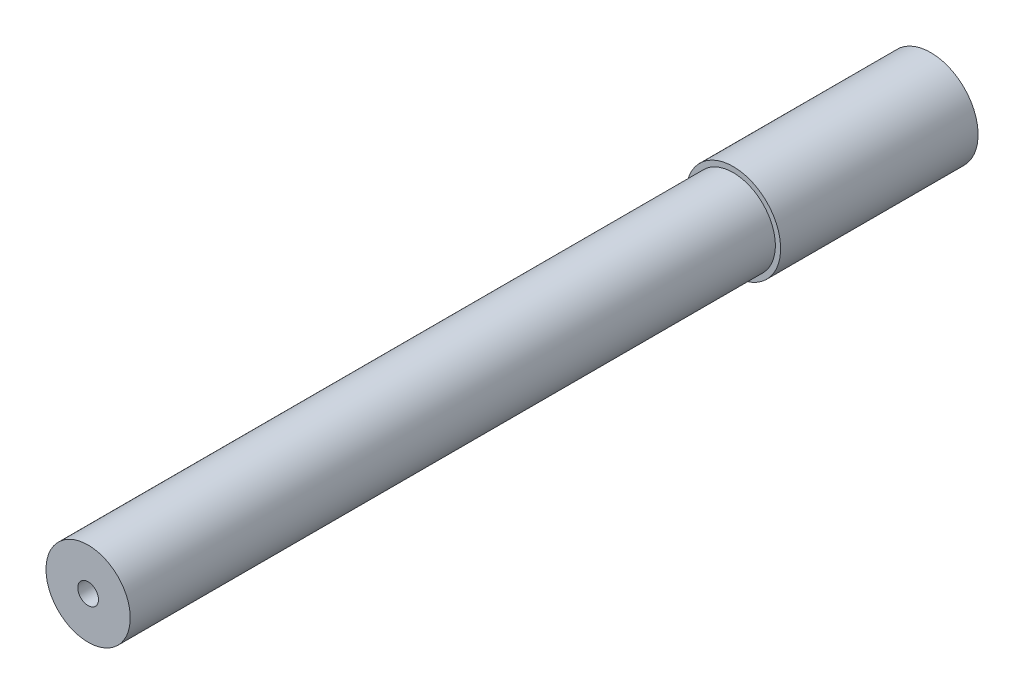
from build123d import *

# Parameters (mm, degrees)
SKETCH2_R             = 9.144
THICKER_SECTION_DEPTH = 38.1
SKETCH3_R             = 8.128
SMALLER_SECTION_DEPTH = 124.46
SKETCH4_R             = 2
CUT_EXTRUDE1_DEPTH    = 19.05


with BuildPart() as part:
    # Sketch2 → Thicker Section (new body)
    with BuildSketch(Plane.XY):
        with Locations(Location((0, 0, 0), (0, 0, 180))):
            Circle(SKETCH2_R)
    extrude(amount=THICKER_SECTION_DEPTH)

    # Sketch3 → Smaller  Section (add)
    with BuildSketch(Plane.XY.offset(38.1)):
        with Locations(Location((0, 0, 0), (0, 0, 180))):
            Circle(SKETCH3_R)
    extrude(amount=SMALLER_SECTION_DEPTH)

    # Sketch4 → Cut-Extrude1 (cut)
    with BuildSketch(Plane.XY.offset(162.56)):
        Circle(SKETCH4_R)
    extrude(amount=-CUT_EXTRUDE1_DEPTH, mode=Mode.SUBTRACT)


solid = part.part
